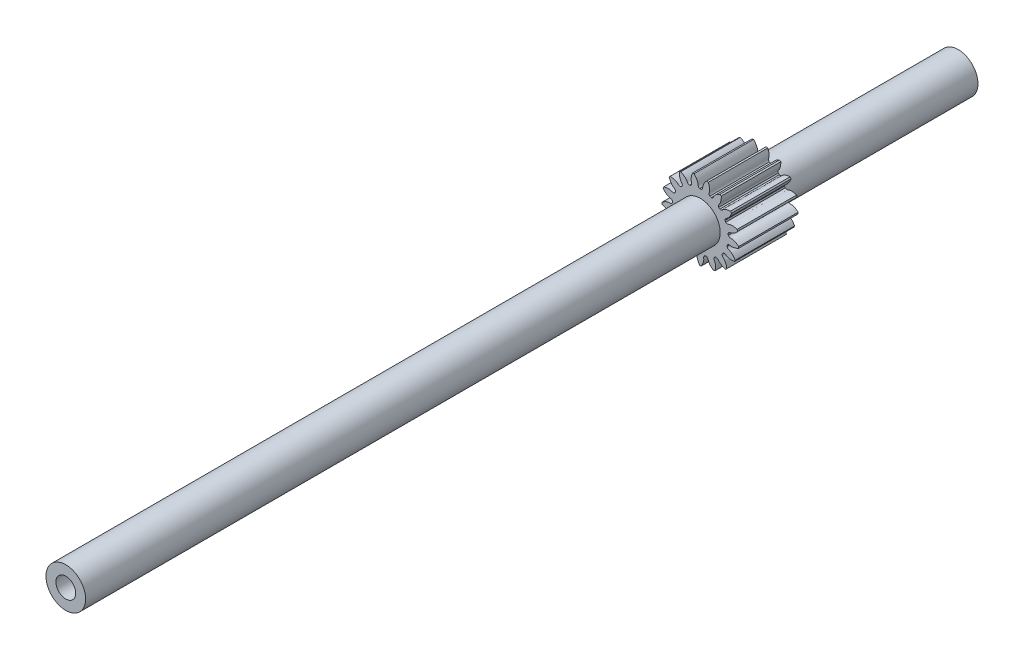
from build123d import *

# Parameters (mm, degrees)
SKETCH_1_R               = 19.4
EXTRUDE_1_DEPTH          = 30
CUT_EXTRUDE_1_DEPTH      = 41.653659122
PATTERN_CIRCULAR_1_COUNT = 17
SKETCH_4_R               = 10
EXTRUDE_2_DEPTH          = 100
EXTRUDE_START            = 320
SKETCH_5_R               = 10
EXTRUDE_3_DEPTH          = 320
SKETCH_6_R               = 5
CUT_EXTRUDE_2_DEPTH      = 10
CUT_EXTRUDE_START        = -10
SKETCH_7_R               = 5
CUT_EXTRUDE_3_DEPTH      = 10


with BuildPart() as part:
    # 草图1 → 凸台-拉伸1 (new body)
    with BuildSketch(Plane.XY):
        Circle(SKETCH_1_R)
    extrude(amount=EXTRUDE_1_DEPTH)

    # 草图2 → 切除-拉伸1 (cut, through all)
    with BuildSketch(Plane.XY):
        with BuildLine():
            ThreePointArc((0.373364028, 14.095055846), (0, 14.1), (-0.373364028, 14.095055846))
            add(Edge.make_bspline(
                [(-0.373364028, 14.095055846), (-1.313089054, 14.584529489), (-1.104422736, 15.389282718), (-1.276610851, 16.129648401), (-1.289951583, 16.18230115), (-1.30603697, 16.24083864), (-1.325101191, 16.305170661), (-1.347383552, 16.375198728), (-1.37311816, 16.450817515), (-1.40253689, 16.531914502), (-1.435868224, 16.618370188), (-1.473337358, 16.710058129), (-1.515165928, 16.80684504), (-1.561571855, 16.908590882), (-1.612769151, 17.015148962), (-1.66896775, 17.12636603), (-1.730373323, 17.242082389), (-1.797187111, 17.362132), (-1.869605751, 17.4863426), (-1.947821109, 17.61453582), (-2.032020115, 17.746527309), (-2.1223846, 17.882126855), (-2.219091138, 18.021138524), (-2.32231089, 18.163360791), (-2.432209452, 18.308586678), (-2.548946705, 18.456603899), (-2.67267667, 18.607195006), (-2.803547366, 18.760137539), (-2.941700674, 18.915204179), (-3.087272199, 19.072162909), (-3.24039114, 19.23077717), (-3.401180166, 19.390806026), (-3.569755292, 19.552004336), (-3.746225758, 19.71412292), (-3.930693918, 19.876908731), (-4.123255131, 20.040105038), (-4.323997649, 20.203451599), (-4.533002522, 20.366684847), (-4.750343497, 20.529538073), (-4.976086929, 20.691741613), (-5.21029169, 20.853023038), (-5.453009087, 21.013107348), (-5.704282782, 21.171717162), (-5.96414873, 21.328572918), (-6.232635058, 21.483393072), (-6.605870276, 21.688781908), (-6.89322305, 21.835751721), (-7.088549834, 21.930870675)],
                knots=[0, 0, 0, 0, 0.204301819, 0.208797289, 0.213892155, 0.219586417, 0.225880075, 0.232773129, 0.240265579, 0.248357425, 0.257048667, 0.266339304, 0.276229338, 0.286718768, 0.297807594, 0.309495816, 0.321783434, 0.334670448, 0.348156858, 0.362242664, 0.376927865, 0.392212463, 0.408096457, 0.424579847, 0.441662633, 0.459344814, 0.477626392, 0.496507366, 0.515987736, 0.536067502, 0.556746663, 0.578025221, 0.599903175, 0.622380525, 0.64545727, 0.669133412, 0.69340895, 0.718283883, 0.743758213, 0.769831939, 0.79650506, 0.823777578, 0.851649492, 0.880120801, 0.909191507, 0.938861609, 1, 1, 1, 1], degree=3))
            ThreePointArc((-7.088549834, 21.930870675), (0, 23.048007014), (7.088549834, 21.930870675))
            add(Edge.make_bspline(
                [(0.373364028, 14.095055846), (1.313089054, 14.584529489), (1.104422736, 15.389282718), (1.276610851, 16.129648401), (1.289951583, 16.18230115), (1.30603697, 16.24083864), (1.325101191, 16.305170661), (1.347383552, 16.375198728), (1.37311816, 16.450817515), (1.40253689, 16.531914502), (1.435868224, 16.618370188), (1.473337358, 16.710058129), (1.515165928, 16.80684504), (1.561571855, 16.908590882), (1.612769151, 17.015148962), (1.66896775, 17.12636603), (1.730373323, 17.242082389), (1.797187111, 17.362132), (1.869605751, 17.4863426), (1.947821109, 17.61453582), (2.032020115, 17.746527309), (2.1223846, 17.882126855), (2.219091138, 18.021138524), (2.32231089, 18.163360791), (2.432209452, 18.308586678), (2.548946705, 18.456603899), (2.67267667, 18.607195006), (2.803547366, 18.760137539), (2.941700674, 18.915204179), (3.087272199, 19.072162909), (3.24039114, 19.23077717), (3.401180166, 19.390806026), (3.569755292, 19.552004336), (3.746225758, 19.71412292), (3.930693918, 19.876908731), (4.123255131, 20.040105038), (4.323997649, 20.203451599), (4.533002522, 20.366684847), (4.750343497, 20.529538073), (4.976086929, 20.691741613), (5.21029169, 20.853023038), (5.453009087, 21.013107348), (5.704282782, 21.171717162), (5.96414873, 21.328572918), (6.232635058, 21.483393072), (6.605870276, 21.688781908), (6.89322305, 21.835751721), (7.088549834, 21.930870675)],
                knots=[0, 0, 0, 0, 0.204301819, 0.208797289, 0.213892155, 0.219586417, 0.225880075, 0.232773129, 0.240265579, 0.248357425, 0.257048667, 0.266339304, 0.276229338, 0.286718768, 0.297807594, 0.309495816, 0.321783434, 0.334670448, 0.348156858, 0.362242664, 0.376927865, 0.392212463, 0.408096457, 0.424579847, 0.441662633, 0.459344814, 0.477626392, 0.496507366, 0.515987736, 0.536067502, 0.556746663, 0.578025221, 0.599903175, 0.622380525, 0.64545727, 0.669133412, 0.69340895, 0.718283883, 0.743758213, 0.769831939, 0.79650506, 0.823777578, 0.851649492, 0.880120801, 0.909191507, 0.938861609, 1, 1, 1, 1], degree=3))
        make_face()
    cut_extrude_1 = extrude(amount=CUT_EXTRUDE_1_DEPTH, mode=Mode.SUBTRACT)

    # 阵列(圆周)1: 切除-拉伸1 ×17 about axis
    pattern_circular_1_axis = Axis((0, 0, -1.5), (0, 0, 1))
    for i in range(1, PATTERN_CIRCULAR_1_COUNT):
        add(cut_extrude_1.rotate(pattern_circular_1_axis, i * 360 / PATTERN_CIRCULAR_1_COUNT), mode=Mode.SUBTRACT)

    # 草图4 → 凸台-拉伸2 (add)
    with BuildSketch(Plane(origin=(0, 0, 0), x_dir=(-1, 0, 0), z_dir=(0, 0, -1))):
        Circle(SKETCH_4_R)
    extrude(amount=EXTRUDE_2_DEPTH)

    # 草图5 → 凸台-拉伸3 (add)
    with BuildSketch(Plane.XY.offset(30).offset(EXTRUDE_START)):
        Circle(SKETCH_5_R)
    extrude(amount=-EXTRUDE_3_DEPTH)

    # 草图6 → 切除-拉伸2 (cut)
    with BuildSketch(Plane(origin=(0, 0, -100), x_dir=(-1, 0, 0), z_dir=(0, 0, -1))):
        Circle(SKETCH_6_R)
    extrude(amount=-CUT_EXTRUDE_2_DEPTH, mode=Mode.SUBTRACT)

    # 草图7 → 切除-拉伸3 (cut)
    with BuildSketch(Plane.XY.offset(350).offset(CUT_EXTRUDE_START)):
        Circle(SKETCH_7_R)
    extrude(amount=CUT_EXTRUDE_3_DEPTH, mode=Mode.SUBTRACT)


solid = part.part
